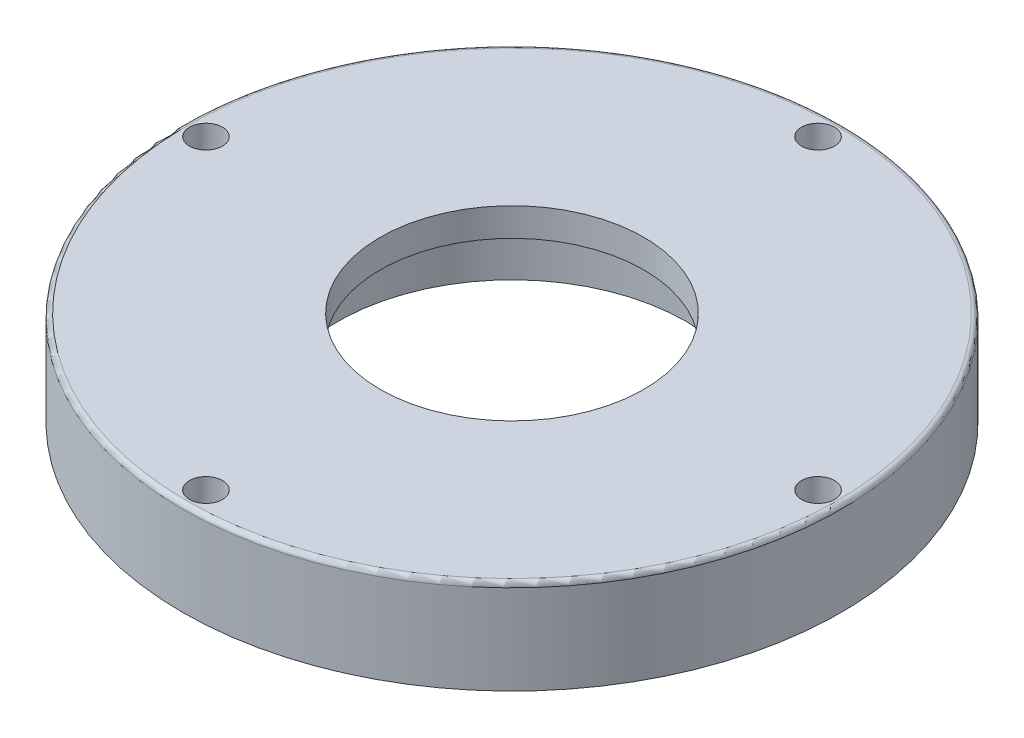
from build123d import *

# Parameters (mm, degrees)
SKETCH1_R           = 35
BOSS_EXTRUDE1_DEPTH = 10
SKETCH2_R           = 1.75
CUT_EXTRUDE1_DEPTH  = 51.497524692
SKETCH4_R           = 18.5
CUT_EXTRUDE2_DEPTH  = 7
SKETCH5_R           = 14
CUT_EXTRUDE3_DEPTH  = 51.497524692
FILLET1_R           = 0.5


with BuildPart() as part:
    # Sketch1 → Boss-Extrude1 (new body)
    with BuildSketch(Plane(origin=(0, 0, 0), x_dir=(1, 0, 0), z_dir=(0, 1, 0))):
        with Locations(Location((0, 0, 0), (0, 0, 270))):
            Circle(SKETCH1_R)
    extrude(amount=BOSS_EXTRUDE1_DEPTH)

    # Sketch2 → Cut-Extrude1 (cut, through all)
    with BuildSketch(Plane(origin=(0, 10, 0), x_dir=(1, 0, 0), z_dir=(0, 1, 0))):
        with Locations(Location((0, 32.5, 0), (0, 0, 270))):
            Circle(SKETCH2_R)
        with Locations(Location((32.5, 0, 0), (0, 0, 270))):
            Circle(SKETCH2_R)
        with Locations(Location((0, -32.5, 0), (0, 0, 270))):
            Circle(SKETCH2_R)
        with Locations(Location((-32.5, 0, 0), (0, 0, 270))):
            Circle(SKETCH2_R)
    extrude(amount=-CUT_EXTRUDE1_DEPTH, mode=Mode.SUBTRACT)

    # Sketch4 → Cut-Extrude2 (cut)
    with BuildSketch(Plane.XZ):
        with Locations(Location((0, 0, 0), (0, 0, 270))):
            Circle(SKETCH4_R)
    extrude(amount=-CUT_EXTRUDE2_DEPTH, mode=Mode.SUBTRACT)

    # Sketch5 → Cut-Extrude3 (cut, through all)
    with BuildSketch(Plane(origin=(0, 10, 0), x_dir=(1, 0, 0), z_dir=(0, 1, 0))):
        with Locations(Location((0, 0, 0), (0, 0, 270))):
            Circle(SKETCH5_R)
    extrude(amount=-CUT_EXTRUDE3_DEPTH, mode=Mode.SUBTRACT)

    # Fillet1
    fillet1_edges = [part.edges().sort_by_distance(p)[0] for p in [
        (0, 10, -35),
    ]]
    fillet(fillet1_edges, radius=FILLET1_R)


solid = part.part
